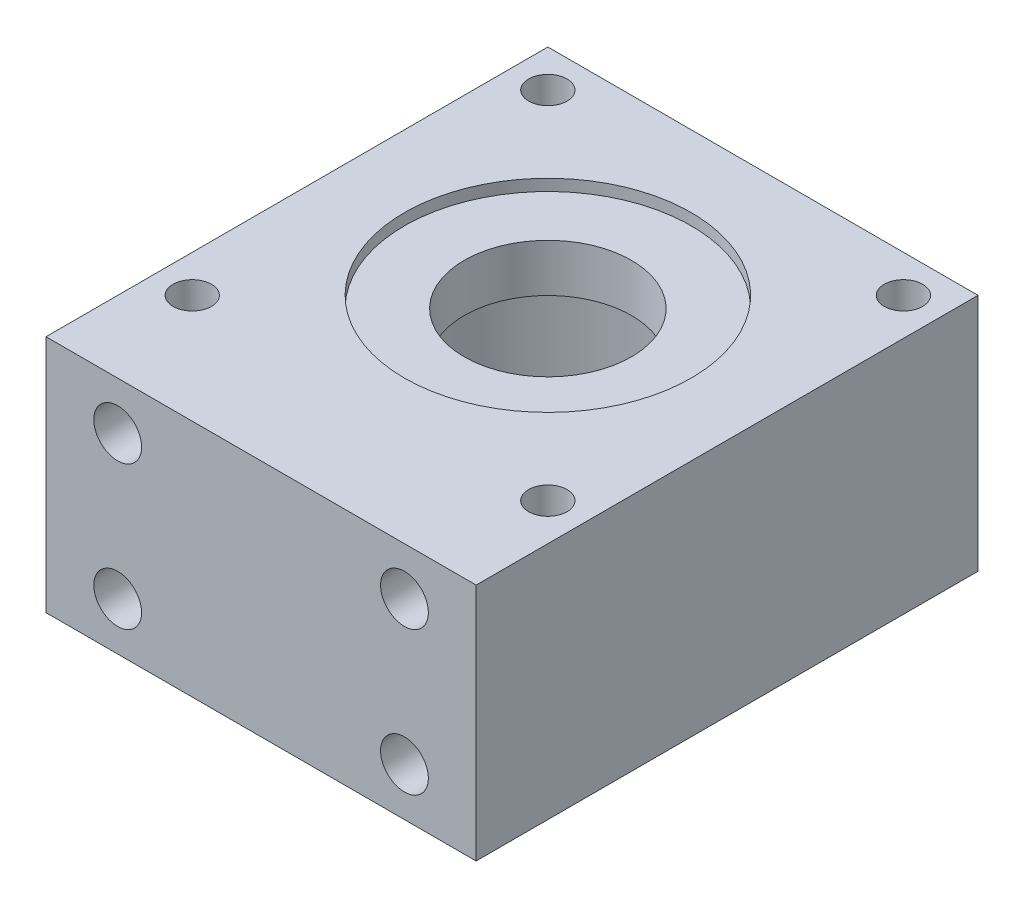
from build123d import *

# Parameters (mm, degrees)
SKETCH1_R                         = 2.5527
BOSS_EXTRUDE1_DEPTH               = 31.75
SKETCH2_R                         = 19.05
CUT_EXTRUDE1_DEPTH                = 1.524
SKETCH3_R                         = 11.1125
CUT_EXTRUDE2_DEPTH                = 57.407018189
CUT_EXTRUDE3_DEPTH                = 23.876
SKETCH5_R                         = 26.19375
CUT_EXTRUDE4_DEPTH                = 17.526
CUT_EXTRUDE5_DEPTH                = 3.175
F_1_4_20_TAPPED_HOLE1_D           = 5.1054
F_1_4_20_TAPPED_HOLE1_DEPTH       = 9.652
F_1_4_20_TAPPED_HOLE1_CBORE_D     = 6.35
F_1_4_20_TAPPED_HOLE1_CBORE_DEPTH = 9.525
F_1_4_20_TAPPED_HOLE1_TIP         = 1.533816902


with BuildPart() as part:
    # Sketch1 → Boss-Extrude1 (new body)
    with BuildSketch(Plane(origin=(0, 0, 0), x_dir=(1, 0, 0), z_dir=(0, 1, 0))):
        Polygon((28.575, 28.575), (-28.575, 28.575), (-28.575, -28.575), (-28.575, -38.1), (28.575, -38.1), (28.575, -28.575), align=None)
        with Locations(Location((23.622, -23.622, 0), (0, 0, 270))):
            Circle(SKETCH1_R, mode=Mode.SUBTRACT)
        with Locations(Location((23.622, 23.622, 0), (0, 0, 270))):
            Circle(SKETCH1_R, mode=Mode.SUBTRACT)
        with Locations(Location((-23.622, 23.622, 0), (0, 0, 270))):
            Circle(SKETCH1_R, mode=Mode.SUBTRACT)
        with Locations(Location((-23.622, -23.622, 0), (0, 0, 270))):
            Circle(SKETCH1_R, mode=Mode.SUBTRACT)
    extrude(amount=BOSS_EXTRUDE1_DEPTH)

    # Sketch2 → Cut-Extrude1 (cut)
    with BuildSketch(Plane(origin=(0, 31.75, 0), x_dir=(1, 0, 0), z_dir=(0, 1, 0))):
        with Locations(Location((0, 0, 0), (0, 0, 270))):
            Circle(SKETCH2_R)
    extrude(amount=-CUT_EXTRUDE1_DEPTH, mode=Mode.SUBTRACT)

    # Sketch3 → Cut-Extrude2 (cut, through all)
    with BuildSketch(Plane(origin=(0, 30.226, 0), x_dir=(1, 0, 0), z_dir=(0, 1, 0))):
        with Locations(Location((0, 0, 0), (0, 0, 270))):
            Circle(SKETCH3_R)
    extrude(amount=-CUT_EXTRUDE2_DEPTH, mode=Mode.SUBTRACT)

    # Sketch4 → Cut-Extrude3 (cut)
    with BuildSketch(Plane.XZ):
        with BuildLine():
            ThreePointArc((0, 20.955), (1.652808564, 21.41912397), (2.822399445, 22.675803874))
            ThreePointArc((2.822399445, 22.675803874), (7.210100154, 24.555346085), (9.885111639, 20.602004462))
            ThreePointArc((9.885111639, 20.602004462), (10.189621648, 18.912489483), (11.32912833, 17.62846778))
            ThreePointArc((11.32912833, 17.62846778), (12.970483736, 17.125337937), (14.633818648, 17.550195776))
            ThreePointArc((14.633818648, 17.550195776), (19.341144607, 16.759197203), (19.454169622, 11.9872142))
            ThreePointArc((19.454169622, 11.9872142), (18.796918984, 10.401273215), (19.061338463, 8.705021597))
            ThreePointArc((19.061338463, 8.705021597), (20.170121967, 7.39437811), (21.799103827, 6.852524522))
            ThreePointArc((21.799103827, 6.852524522), (25.331512305, 3.642121623), (22.846666207, -0.433431873))
            ThreePointArc((22.846666207, -0.433431873), (21.436327355, -1.412273807), (20.741708315, -2.982207436))
            ThreePointArc((20.741708315, -2.982207436), (20.965888988, -4.68424452), (22.043327566, -6.02077485))
            ThreePointArc((22.043327566, -6.02077485), (23.27930383, -10.631301837), (18.985507698, -12.716466389))
            ThreePointArc((18.985507698, -12.716466389), (17.269853253, -12.777433874), (15.836732331, -13.72260668))
            ThreePointArc((15.836732331, -13.72260668), (15.105134394, -15.275652613), (15.288950554, -16.982520747))
            ThreePointArc((15.288950554, -16.982520747), (13.836080873, -21.529362082), (9.09658464, -20.962112676))
            ThreePointArc((9.09658464, -20.962112676), (7.620322766, -20.085848967), (5.903705729, -20.106175262))
            ThreePointArc((5.903705729, -20.106175262), (4.448606357, -21.017148933), (3.680439768, -22.552436301))
            ThreePointArc((3.680439768, -22.552436301), (0, -25.592001984), (-3.680439768, -22.552436301))
            ThreePointArc((-3.680439768, -22.552436301), (-4.448606357, -21.017148933), (-5.903705729, -20.106175262))
            ThreePointArc((-5.903705729, -20.106175262), (-7.620322766, -20.085848967), (-9.09658464, -20.962112676))
            ThreePointArc((-9.09658464, -20.962112676), (-13.836080873, -21.529362082), (-15.288950554, -16.982520747))
            ThreePointArc((-15.288950554, -16.982520747), (-15.105134394, -15.275652613), (-15.836732331, -13.72260668))
            ThreePointArc((-15.836732331, -13.72260668), (-17.269853253, -12.777433874), (-18.985507698, -12.716466389))
            ThreePointArc((-18.985507698, -12.716466389), (-23.27930383, -10.631301837), (-22.043327566, -6.02077485))
            ThreePointArc((-22.043327566, -6.02077485), (-20.965888988, -4.68424452), (-20.741708315, -2.982207436))
            ThreePointArc((-20.741708315, -2.982207436), (-21.436327355, -1.412273807), (-22.846666207, -0.433431873))
            ThreePointArc((-22.846666207, -0.433431873), (-25.331512305, 3.642121623), (-21.799103827, 6.852524522))
            ThreePointArc((-21.799103827, 6.852524522), (-20.170121967, 7.39437811), (-19.061338463, 8.705021597))
            ThreePointArc((-19.061338463, 8.705021597), (-18.796918984, 10.401273215), (-19.454169622, 11.9872142))
            ThreePointArc((-19.454169622, 11.9872142), (-19.341144607, 16.759197203), (-14.633818648, 17.550195776))
            ThreePointArc((-14.633818648, 17.550195776), (-12.970483736, 17.125337937), (-11.32912833, 17.62846778))
            ThreePointArc((-11.32912833, 17.62846778), (-10.189621648, 18.912489483), (-9.885111639, 20.602004462))
            ThreePointArc((-9.885111639, 20.602004462), (-7.210100154, 24.555346085), (-2.822399445, 22.675803874))
            ThreePointArc((-2.822399445, 22.675803874), (-1.652808564, 21.41912397), (0, 20.955))
        make_face()
    extrude(amount=-CUT_EXTRUDE3_DEPTH, mode=Mode.SUBTRACT)

    # Sketch5 → Cut-Extrude4 (cut)
    with BuildSketch(Plane.XZ):
        with Locations(Location((0, 0, 0), (0, 0, 270))):
            Circle(SKETCH5_R)
    extrude(amount=-CUT_EXTRUDE4_DEPTH, mode=Mode.SUBTRACT)

    # Sketch7 → Cut-Extrude5 (cut)
    with BuildSketch(Plane.XZ):
        with BuildLine():
            Line((-23.8125, 26.9875), (23.8125, 26.9875))
            ThreePointArc((23.8125, 26.9875), (26.05756403, 26.05756403), (26.9875, 23.8125))
            Line((26.9875, 23.8125), (26.9875, -23.8125))
            ThreePointArc((26.9875, -23.8125), (26.05756403, -26.05756403), (23.8125, -26.9875))
            Line((23.8125, -26.9875), (-23.8125, -26.9875))
            ThreePointArc((-23.8125, -26.9875), (-26.05756403, -26.05756403), (-26.9875, -23.8125))
            Line((-26.9875, -23.8125), (-26.9875, 23.8125))
            ThreePointArc((-26.9875, 23.8125), (-26.05756403, 26.05756403), (-23.8125, 26.9875))
        make_face()
    extrude(amount=-CUT_EXTRUDE5_DEPTH, mode=Mode.SUBTRACT)

    # 1/4-20 Tapped Hole1
    with Locations(Plane.XY.offset(38.1)):
        with Locations((-19.05, 25.4), (19.05, 25.4), (19.05, 6.35), (-19.05, 6.35)):
            CounterBoreHole(F_1_4_20_TAPPED_HOLE1_D / 2, F_1_4_20_TAPPED_HOLE1_CBORE_D / 2, F_1_4_20_TAPPED_HOLE1_CBORE_DEPTH, depth=F_1_4_20_TAPPED_HOLE1_DEPTH)
            with Locations((0, 0, -(F_1_4_20_TAPPED_HOLE1_DEPTH + F_1_4_20_TAPPED_HOLE1_TIP / 2))):  # 118° drill point
                Cone(0, F_1_4_20_TAPPED_HOLE1_D / 2, F_1_4_20_TAPPED_HOLE1_TIP, mode=Mode.SUBTRACT)


solid = part.part
